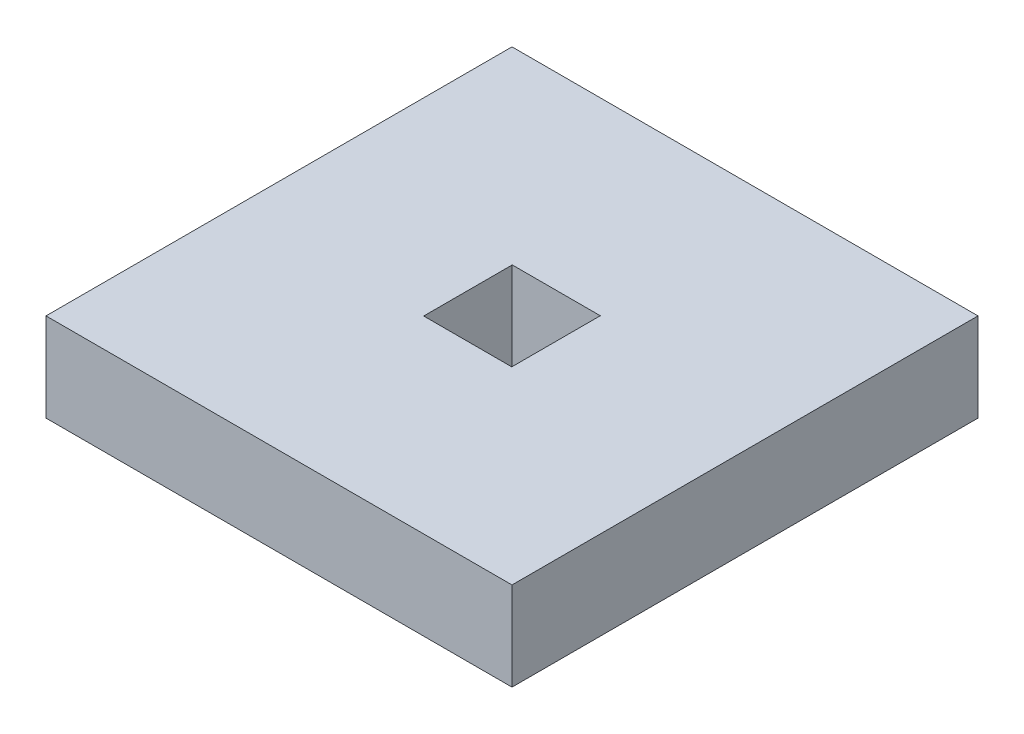
from build123d import *

# Parameters (mm, degrees)
SKETCH1_W           = 25.4
SKETCH1_H           = 25.4
BOSS_EXTRUDE1_DEPTH = 4.826
SKETCH2_W           = 4.800000052
SKETCH2_H           = 4.826
CUT_EXTRUDE1_DEPTH  = 37.243761891


with BuildPart() as part:
    # Sketch1 → Boss-Extrude1 (new body)
    with BuildSketch(Plane(origin=(0, 0, 0), x_dir=(1, 0, 0), z_dir=(0, 1, 0))):
        with Locations((12.7, 12.7)):
            Rectangle(SKETCH1_W, SKETCH1_H)
    extrude(amount=BOSS_EXTRUDE1_DEPTH)

    # Sketch2 → Cut-Extrude1 (cut, through all)
    with BuildSketch(Plane(origin=(0, 4.826, 0), x_dir=(1, 0, 0), z_dir=(0, 1, 0))):
        with Locations((12.7, 12.7)):
            Rectangle(SKETCH2_W, SKETCH2_H)
    extrude(amount=-CUT_EXTRUDE1_DEPTH, mode=Mode.SUBTRACT)


solid = part.part
